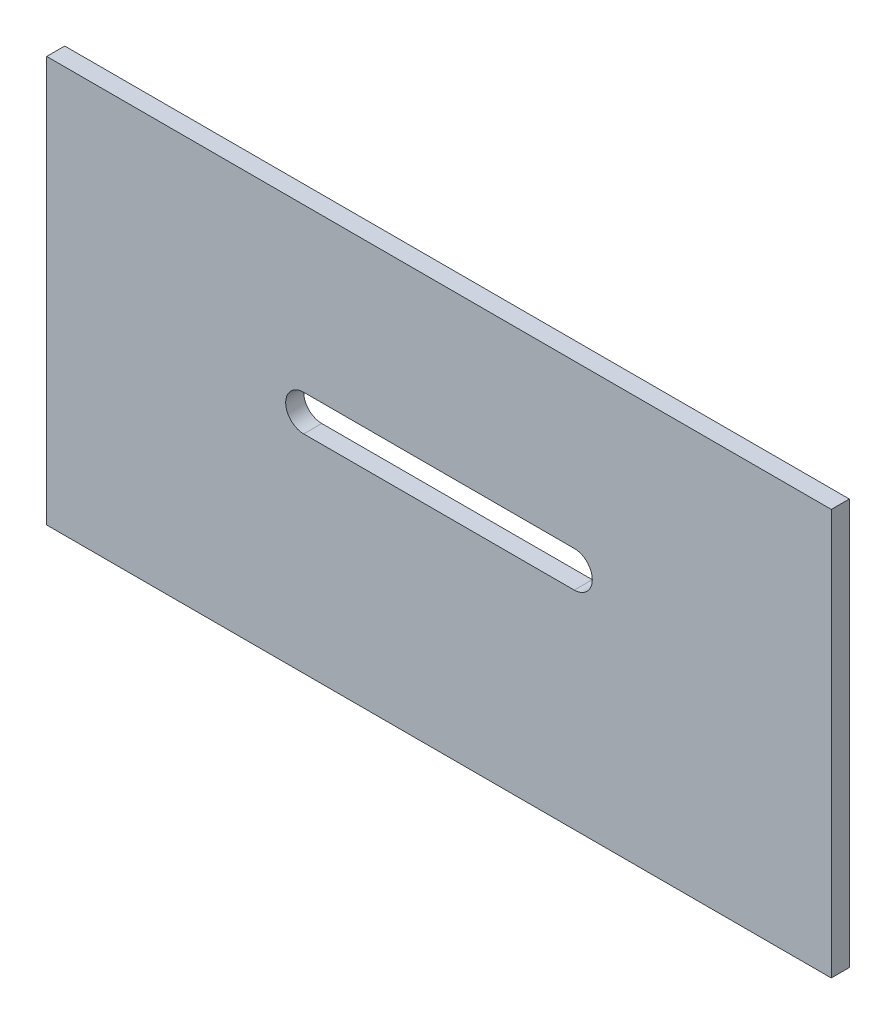
from build123d import *

# Parameters (mm, degrees)
SKETCH1_W           = 87
SKETCH1_H           = 45
BOSS_EXTRUDE1_DEPTH = 2
CUT_EXTRUDE1_DEPTH  = 2


with BuildPart() as part:
    # Sketch1 → Boss-Extrude1 (new body)
    with BuildSketch(Plane.XY):
        Rectangle(SKETCH1_W, SKETCH1_H)
    extrude(amount=BOSS_EXTRUDE1_DEPTH)

    # Sketch2 → Cut-Extrude1 (cut)
    with BuildSketch(Plane.XY.offset(2)):
        with BuildLine():
            Line((-15, 4.5), (15, 4.5))
            ThreePointArc((15, 4.5), (17, 2.5), (15, 0.5))
            Line((15, 0.5), (-15, 0.5))
            ThreePointArc((-15, 0.5), (-17, 2.5), (-15, 4.5))
        make_face()
    extrude(amount=-CUT_EXTRUDE1_DEPTH, mode=Mode.SUBTRACT)


solid = part.part
